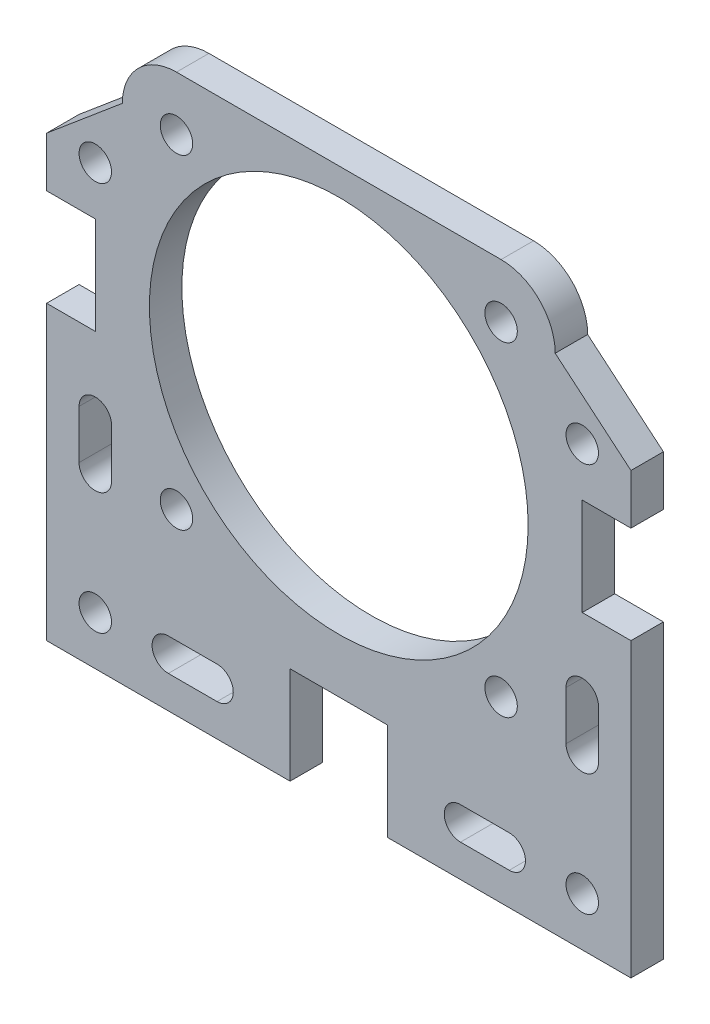
from build123d import *

# Parameters (mm, degrees)
MODEL_R                 = 17.5
MODEL_R_2               = 1.5
SALIENTE_EXTRUIR1_DEPTH = 3


with BuildPart() as part:
    # Model → Saliente-Extruir1 (new body)
    with BuildSketch(Plane.XY):
        with BuildLine():
            Line((119.290027295, 223.651688958), (119.290027295, 219.036053988))
            Line((119.290027295, 219.036053988), (123.790027295, 219.036053988))
            Line((123.790027295, 219.036053988), (123.790027295, 210.036053988))
            Line((123.790027295, 210.036053988), (119.290027295, 210.036053988))
            Line((119.290027295, 210.036053988), (119.290027295, 183.036053988))
            Line((119.290027295, 183.036053988), (141.790027295, 183.036053988))
            Line((141.790027295, 183.036053988), (141.790027295, 192.036053988))
            Line((141.790027295, 192.036053988), (150.790027295, 192.036053988))
            Line((150.790027295, 192.036053988), (150.790027295, 183.036053988))
            Line((150.790027295, 183.036053988), (173.290027295, 183.036053988))
            Line((173.290027295, 183.036053988), (173.290027295, 210.036053988))
            Line((173.290027295, 210.036053988), (168.790027295, 210.036053988))
            Line((168.790027295, 210.036053988), (168.790027295, 219.036053988))
            Line((168.790027295, 219.036053988), (173.290027295, 219.036053988))
            Line((173.290027295, 219.036053988), (173.290027295, 223.651688958))
            Line((173.290027295, 223.651688958), (166.290027295, 229.536053988))
            ThreePointArc((166.290027295, 229.536053988), (164.825561201, 233.071587894), (161.290027295, 234.536053988))
            Line((161.290027295, 234.536053988), (131.290027295, 234.536053988))
            ThreePointArc((131.290027295, 234.536053988), (127.754493389, 233.071587894), (126.290027295, 229.536053988))
            Line((126.290027295, 229.536053988), (119.290027295, 223.651688958))
        make_face()
        with Locations((146.290027295, 214.536053988)):
            Circle(MODEL_R, mode=Mode.SUBTRACT)
        with Locations((168.790027295, 223.536053988)):
            Circle(MODEL_R_2, mode=Mode.SUBTRACT)
        with Locations((161.290027295, 229.536053988)):
            Circle(MODEL_R_2, mode=Mode.SUBTRACT)
        with Locations((168.790027295, 187.536053988)):
            Circle(MODEL_R_2, mode=Mode.SUBTRACT)
        with Locations((161.290027295, 199.536053988)):
            Circle(MODEL_R_2, mode=Mode.SUBTRACT)
        with Locations((123.790027295, 223.536053988)):
            Circle(MODEL_R_2, mode=Mode.SUBTRACT)
        with Locations((131.290027295, 229.536053988)):
            Circle(MODEL_R_2, mode=Mode.SUBTRACT)
        with Locations((131.290027295, 199.536053988)):
            Circle(MODEL_R_2, mode=Mode.SUBTRACT)
        with Locations((123.790027295, 187.536053988)):
            Circle(MODEL_R_2, mode=Mode.SUBTRACT)
        with BuildLine():
            Line((122.290027295, 203.286053988), (122.290027295, 198.786053988))
            ThreePointArc((122.290027295, 198.786053988), (123.790027295, 197.286053988), (125.290027295, 198.786053988))
            Line((125.290027295, 198.786053988), (125.290027295, 203.286053988))
            ThreePointArc((125.290027295, 203.286053988), (123.790027295, 204.786053988), (122.290027295, 203.286053988))
        make_face(mode=Mode.SUBTRACT)
        with BuildLine():
            Line((167.290027295, 203.286053988), (167.290027295, 198.786053988))
            ThreePointArc((167.290027295, 198.786053988), (168.790027295, 197.286053988), (170.290027295, 198.786053988))
            Line((170.290027295, 198.786053988), (170.290027295, 203.286053988))
            ThreePointArc((170.290027295, 203.286053988), (168.790027295, 204.786053988), (167.290027295, 203.286053988))
        make_face(mode=Mode.SUBTRACT)
        with BuildLine():
            Line((162.040027295, 189.036053988), (157.540027295, 189.036053988))
            ThreePointArc((157.540027295, 189.036053988), (156.040027295, 187.536053988), (157.540027295, 186.036053988))
            Line((157.540027295, 186.036053988), (162.040027295, 186.036053988))
            ThreePointArc((162.040027295, 186.036053988), (163.540027295, 187.536053988), (162.040027295, 189.036053988))
        make_face(mode=Mode.SUBTRACT)
        with BuildLine():
            Line((135.040027295, 186.036053988), (130.540027295, 186.036053988))
            ThreePointArc((130.540027295, 186.036053988), (129.040027295, 187.536053988), (130.540027295, 189.036053988))
            Line((130.540027295, 189.036053988), (135.040027295, 189.036053988))
            ThreePointArc((135.040027295, 189.036053988), (136.540027295, 187.536053988), (135.040027295, 186.036053988))
        make_face(mode=Mode.SUBTRACT)
    extrude(amount=SALIENTE_EXTRUIR1_DEPTH)


solid = part.part
